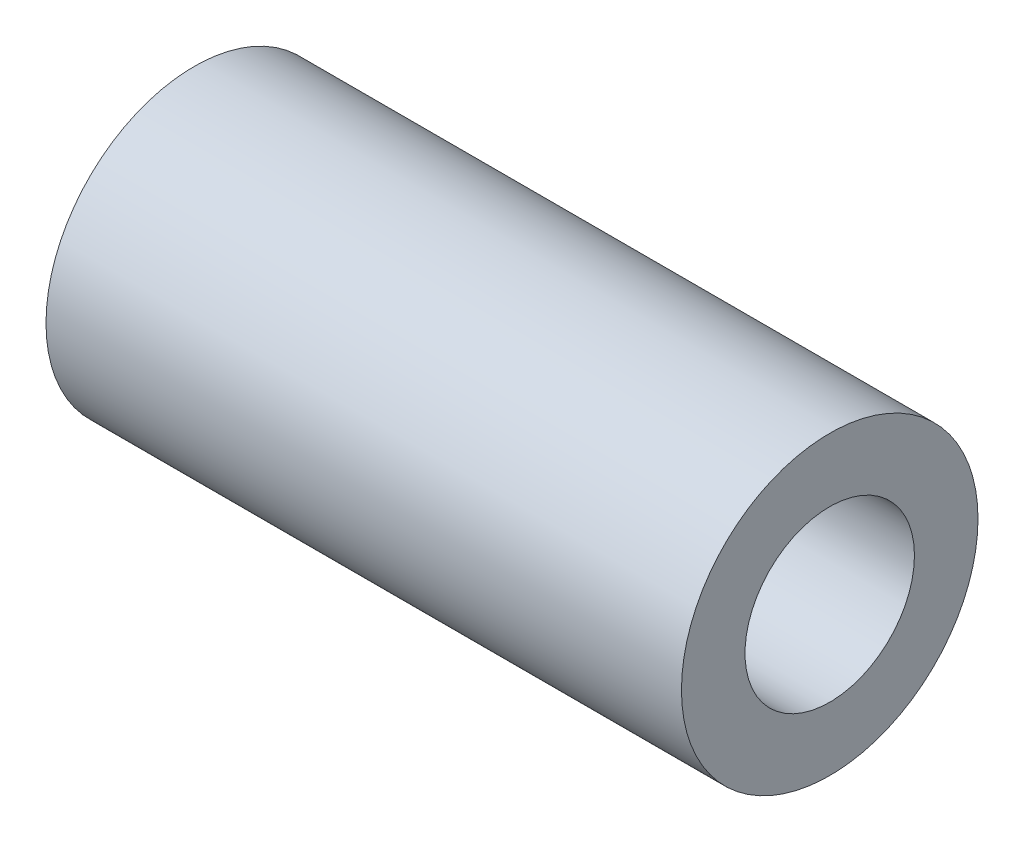
from build123d import *

# Parameters (mm, degrees)
SKETCH_1_R      = 3.5
SKETCH_1_R_2    = 2
EXTRUDE_1_DEPTH = 7.5


with BuildPart() as part:
    # 草图1 → 凸台-拉伸1 (new, symmetric)
    with BuildSketch(Plane(origin=(0, 0, 0), x_dir=(0, 0, -1), z_dir=(1, 0, 0))):
        Circle(SKETCH_1_R)
        Circle(SKETCH_1_R_2, mode=Mode.SUBTRACT)
    extrude(amount=EXTRUDE_1_DEPTH, both=True)


solid = part.part
